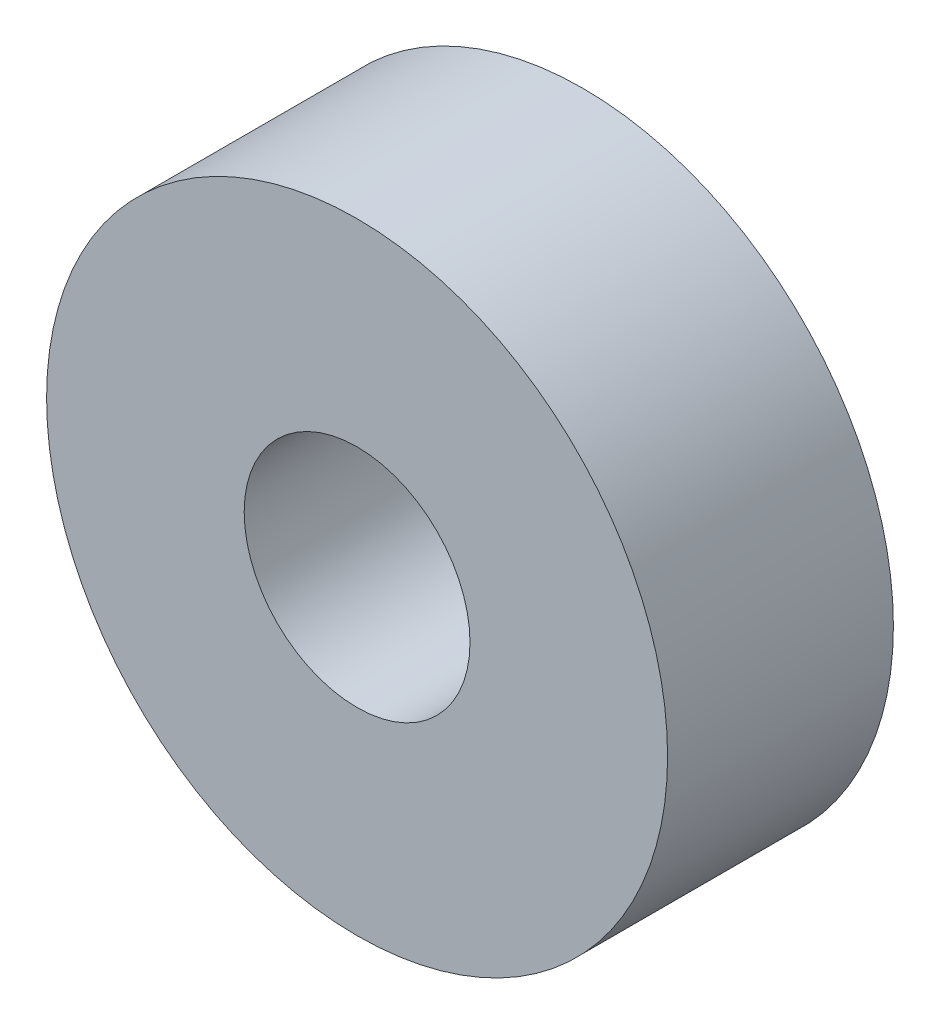
from build123d import *

# Parameters (mm, degrees)
SKETCH1_R           = 11
SKETCH1_R_2         = 4
BOSS_EXTRUDE1_DEPTH = 8


with BuildPart() as part:
    # Sketch1 → Boss-Extrude1 (new body)
    with BuildSketch(Plane.XY):
        Circle(SKETCH1_R)
        Circle(SKETCH1_R_2, mode=Mode.SUBTRACT)
    extrude(amount=BOSS_EXTRUDE1_DEPTH)


solid = part.part
